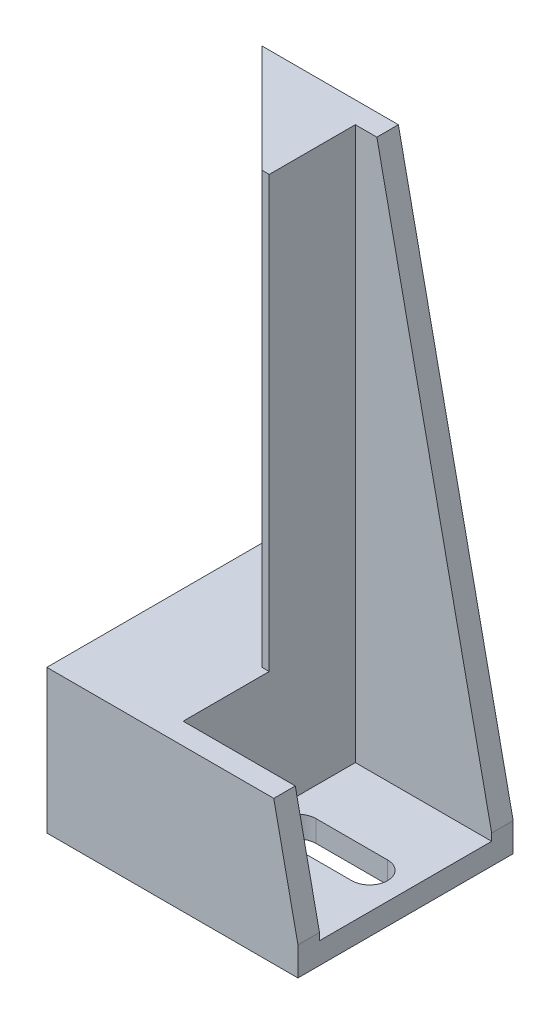
from build123d import *

# Parameters (mm, degrees)
BOSS_EXTRUDE1_DEPTH = 38.1
SHELL1_T            = -3.81
CUT_EXTRUDE1_DEPTH  = 3.81
BOSS_EXTRUDE2_DEPTH = 101.6
SKETCH5_W           = 24.13
SKETCH5_H           = 30.48
CUT_EXTRUDE2_DEPTH  = 97.79
BOSS_EXTRUDE3_DEPTH = 25.4
SKETCH9_W           = 44.45
SKETCH9_H           = 19.05
CUT_EXTRUDE4_DEPTH  = 76.2


with BuildPart() as part:
    # Sketch1 → Boss-Extrude1 (new body)
    with BuildSketch(Plane.XY):
        Polygon((0, 0), (25.4, 0), (25.4, 5.08), (5.08, 101.6), (0, 101.6), align=None)
    extrude(amount=BOSS_EXTRUDE1_DEPTH)

    # Shell1
    shell1_openings = [part.faces().sort_by_distance(p)[0] for p in [
        (15.24, 53.34, 19.05),
    ]]
    offset(amount=SHELL1_T, openings=shell1_openings, kind=Kind.INTERSECTION)

    # Sketch2 → Cut-Extrude1 (cut)
    with BuildSketch(Plane.XZ):
        with BuildLine():
            Line((6.35, 22.225), (19.05, 22.225))
            ThreePointArc((19.05, 22.225), (22.225, 19.05), (19.05, 15.875))
            Line((19.05, 15.875), (6.35, 15.875))
            ThreePointArc((6.35, 15.875), (3.175, 19.05), (6.35, 22.225))
        make_face()
    extrude(amount=-CUT_EXTRUDE1_DEPTH, mode=Mode.SUBTRACT)

    # Sketch3 → Boss-Extrude2 (add)
    with BuildSketch(Plane(origin=(0, 101.6, 0), x_dir=(1, 0, 0), z_dir=(0, 1, 0))):
        Polygon((-19.05, 0), (0, -19.05), (0, 0), align=None)
        Polygon((0, -38.1), (0, -19.05), (-19.05, -38.1), align=None)
    extrude(amount=-BOSS_EXTRUDE2_DEPTH)

    # Sketch5 → Cut-Extrude2 (cut)
    with BuildSketch(Plane(origin=(0, 101.6, 0), x_dir=(1, 0, 0), z_dir=(0, 1, 0))):
        with Locations((13.335, -19.05)):
            Rectangle(SKETCH5_W, SKETCH5_H)
    extrude(amount=-CUT_EXTRUDE2_DEPTH, mode=Mode.SUBTRACT)

    # Sketch6 → Boss-Extrude3 (add)
    with BuildSketch(Plane.XZ):
        Polygon((-19.05, 0), (0, 19.05), (-19.05, 38.1), align=None)
    extrude(amount=-BOSS_EXTRUDE3_DEPTH)

    # Sketch9 → Cut-Extrude4 (cut)
    with BuildSketch(Plane(origin=(0, 101.6, 0), x_dir=(1, 0, 0), z_dir=(0, 1, 0))):
        with Locations((3.175, -28.575)):
            Rectangle(SKETCH9_W, SKETCH9_H)
    extrude(amount=-CUT_EXTRUDE4_DEPTH, mode=Mode.SUBTRACT)


solid = part.part
